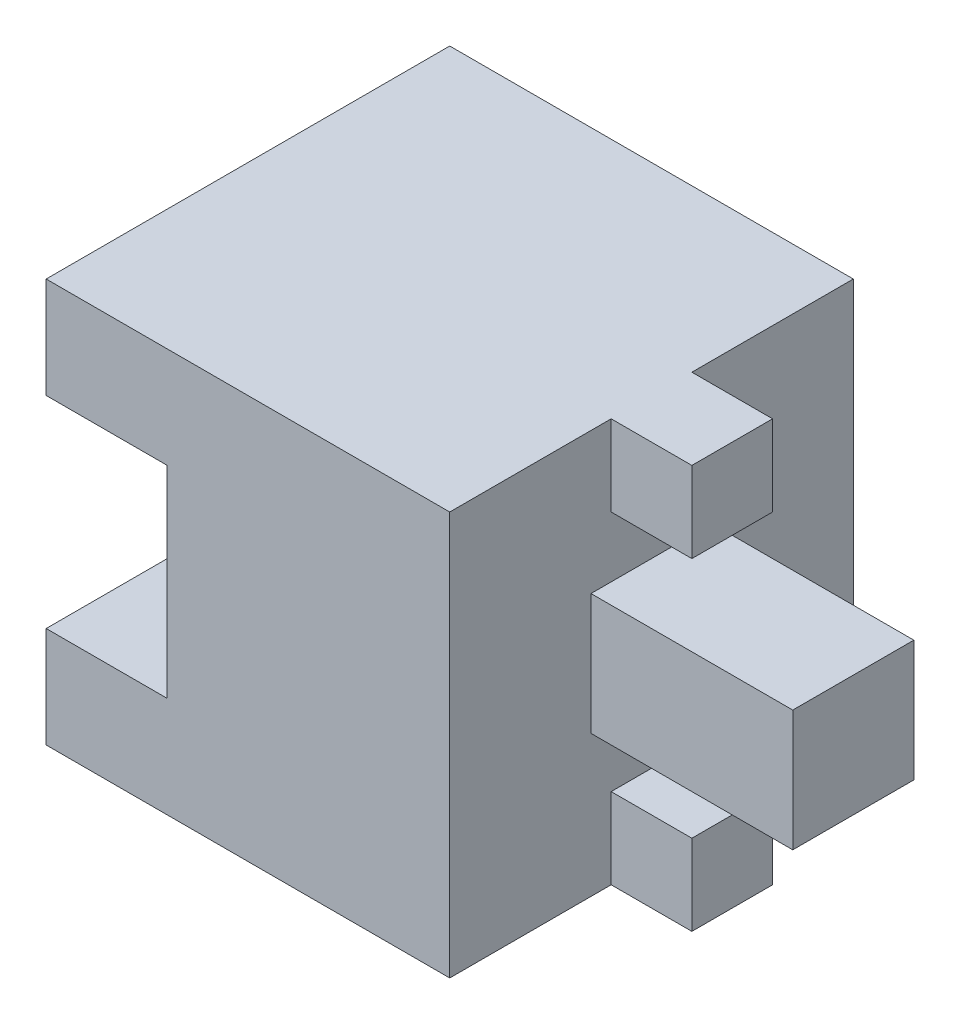
from build123d import *

# Parameters (mm, degrees)
SKETCH1_W           = 10
SKETCH1_H           = 10
BOSS_EXTRUDE1_DEPTH = 5
SKETCH2_W           = 3
SKETCH2_H           = 5
CUT_EXTRUDE1_DEPTH  = 13.247448714
SKETCH3_W           = 3
SKETCH3_H           = 3
BOSS_EXTRUDE2_DEPTH = 5
SKETCH4_W           = 2
SKETCH4_H           = 2
BOSS_EXTRUDE3_DEPTH = 2


with BuildPart() as part:
    # Sketch1 → Boss-Extrude1 (new, symmetric)
    with BuildSketch(Plane(origin=(0, 0, 0), x_dir=(1, 0, 0), z_dir=(0, 1, 0))):
        Rectangle(SKETCH1_W, SKETCH1_H)
    extrude(amount=BOSS_EXTRUDE1_DEPTH, both=True)

    # Sketch2 → Cut-Extrude1 (cut, through all)
    with BuildSketch(Plane.XY.offset(5)):
        with Locations((-3.5, 0)):
            Rectangle(SKETCH2_W, SKETCH2_H)
    extrude(amount=-CUT_EXTRUDE1_DEPTH, mode=Mode.SUBTRACT)

    # Sketch3 → Boss-Extrude2 (add)
    with BuildSketch(Plane(origin=(5, 0, 0), x_dir=(0, 0, -1), z_dir=(1, 0, 0))):
        Rectangle(SKETCH3_W, SKETCH3_H)
    extrude(amount=BOSS_EXTRUDE2_DEPTH)

    # Sketch4 → Boss-Extrude3 (add)
    with BuildSketch(Plane(origin=(5, 0, 0), x_dir=(0, 0, -1), z_dir=(1, 0, 0))):
        with Locations((0, 4)):
            Rectangle(SKETCH4_W, SKETCH4_H)
    boss_extrude3 = extrude(amount=BOSS_EXTRUDE3_DEPTH)

    # Mirror1: Boss-Extrude3 across plane
    add(boss_extrude3.mirror(Plane.ZX))


solid = part.part
